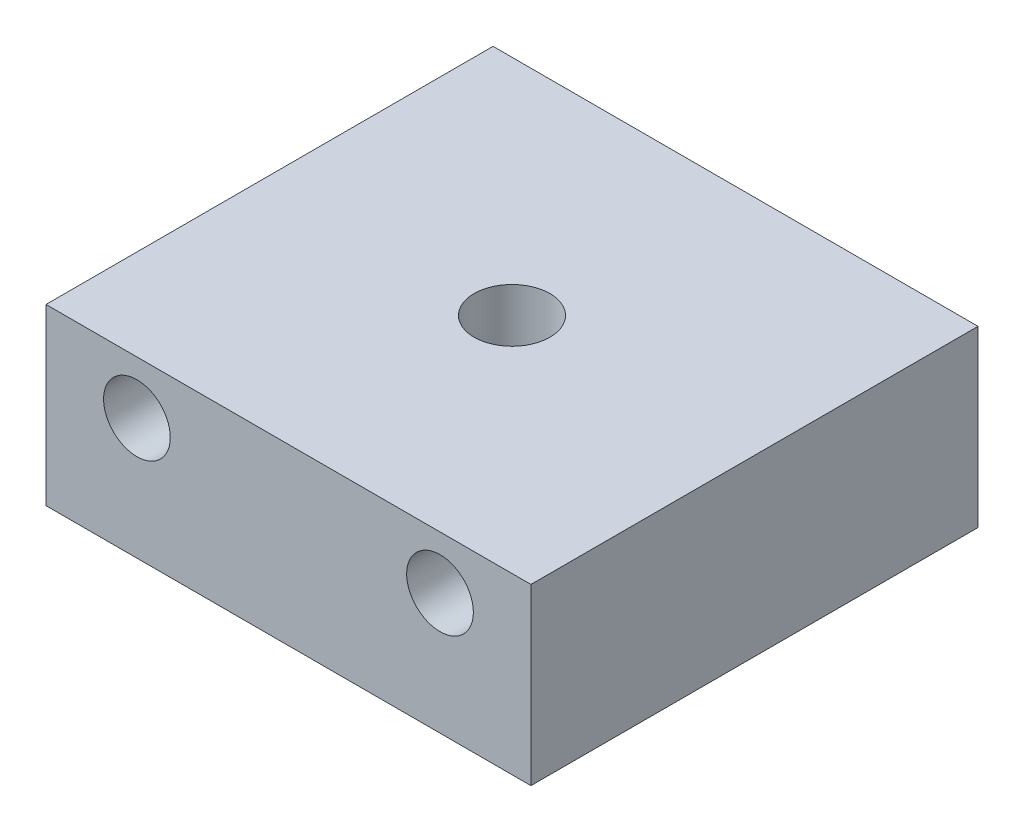
from build123d import *

# Parameters (mm, degrees)
SKETCH_1_W          = 31.99999989
SKETCH_1_H          = 11.5
SKETCH_1_R          = 2.2
EXTRUDE_1_DEPTH     = 29.5
SKETCH_2_R          = 2.5
CUT_EXTRUDE_1_DEPTH = 29.5


with BuildPart() as part:
    # 草图1 → 凸台-拉伸1 (new body)
    with BuildSketch(Plane.XY):
        with Locations((17.999999945, -43.99)):
            Rectangle(SKETCH_1_W, SKETCH_1_H)
        with Locations((8, -41.74)):
            Circle(SKETCH_1_R, mode=Mode.SUBTRACT)
        with Locations((27.99999989, -41.737899898)):
            Circle(SKETCH_1_R, mode=Mode.SUBTRACT)
    extrude(amount=EXTRUDE_1_DEPTH)

    # 草图2 → 切除-拉伸1 (cut)
    with BuildSketch(Plane.XZ.offset(49.74)):
        with Locations(Location((17.999999945, 14.75, 0), (0, 0, 270))):
            Circle(SKETCH_2_R)
    extrude(amount=-CUT_EXTRUDE_1_DEPTH, mode=Mode.SUBTRACT)


solid = part.part
